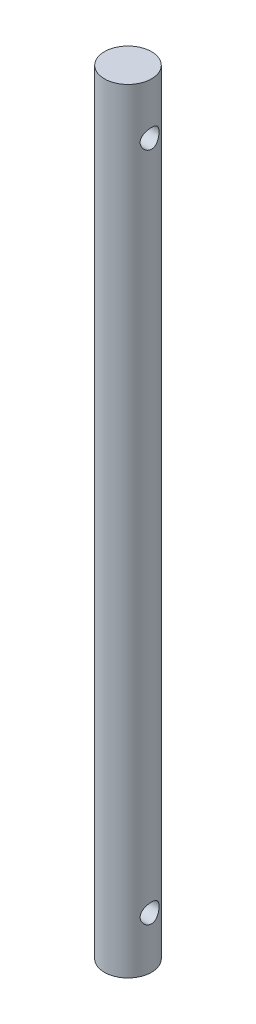
from build123d import *

# Parameters (mm, degrees)
SKETCH1_R           = 3.9624
BOSS_EXTRUDE1_DEPTH = 65.0875
SKETCH2_W           = 30.608403034
SKETCH2_H           = 1.5875


with BuildPart() as part:
    # Sketch1 → Boss-Extrude1 (new, symmetric)
    with BuildSketch(Plane(origin=(0, 0, 0), x_dir=(1, 0, 0), z_dir=(0, 1, 0))):
        with Locations(Location((0, 0, 0), (0, 0, 270))):
            Circle(SKETCH1_R)
    extrude(amount=BOSS_EXTRUDE1_DEPTH, both=True)

    # Sketch2 → Cut-Revolve1 (revolve, cut)
    with BuildSketch(Plane.XY, mode=Mode.PRIVATE) as cut_revolve1_sk:
        with Locations((-0.141456304, 57.21985)):
            Rectangle(SKETCH2_W, SKETCH2_H)
    cut_revolve1 = revolve(cut_revolve1_sk.sketch.rotate(Axis((-15.445657821, 56.4261, 0), (1, 0, 0)), 90), axis=Axis((-15.445657821, 56.4261, 0), (1, 0, 0)), mode=Mode.SUBTRACT)

    # Mirror1: Cut-Revolve1 across plane
    add(cut_revolve1.mirror(Plane.ZX), mode=Mode.SUBTRACT)


solid = part.part
